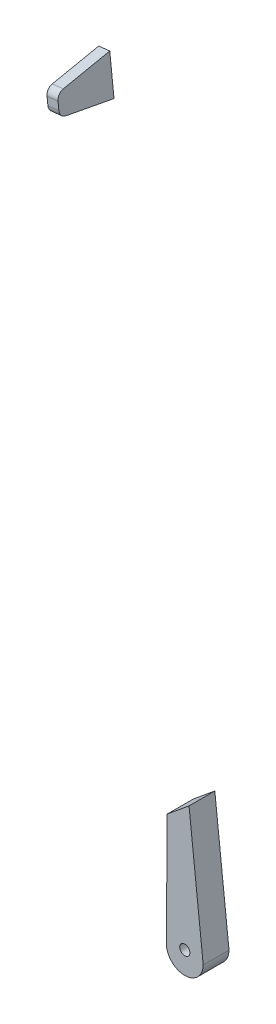
from build123d import *

# Parameters (mm, degrees)
SKETCH1_R                = 1.7526
BOSS_EXTRUDE1_DEPTH      = 8.89
BOSS_EXTRUDE2_DEPTH      = 1.905
BOSS_EXTRUDE2_DEPTH_BACK = 1.905
BOSS_EXTRUDE2_START      = 6.35


with BuildPart() as part:
    # Sketch1 → Boss-Extrude1 (new body)
    with BuildSketch(Plane.XY.offset(686.809186753)):
        with BuildLine():
            Line((1900.888851589, 19.620446581), (1896.001061366, 64.693409066))
            ThreePointArc((1896.001061366, 64.693409066), (1892.243741214, 61.598932687), (1888.49175705, 58.497988698))
            Line((1888.49175705, 58.497988698), (1888.165665709, 19.749246166))
            ThreePointArc((1888.165665709, 19.749246166), (1894.462858856, 13.323253433), (1900.888851589, 19.620446581))
        make_face()
        with Locations((1894.537558365, 20.954804607)):
            Circle(SKETCH1_R, mode=Mode.SUBTRACT)
    extrude(amount=BOSS_EXTRUDE1_DEPTH)


with BuildPart() as body_2:
    # Sketch2 → Boss-Extrude2 (new, two sides: drawn at the far end of the back side and taken through both)
    with BuildSketch(Plane(origin=(1880.901419931, 203.935385675, 0), x_dir=(0, 0, 1), z_dir=(-0.9941715502675706, -0.10780968712771334, 0)).offset(BOSS_EXTRUDE2_START - BOSS_EXTRUDE2_DEPTH_BACK)):
        with BuildLine():
            Line((697.909018497, 72.823574899), (695.608660835, 73.244562676))
            Line((695.608660835, 73.244562676), (695.607635569, 70.25390024))
            Line((695.607635569, 70.25390024), (695.604012875, 59.686643231))
            Line((695.604012875, 59.686643231), (711.930786275, 62.543686297))
            ThreePointArc((711.930786275, 62.543686297), (713.437656121, 63.41172663), (714.032961387, 65.045667386))
            Line((714.032961387, 65.045667386), (714.032961387, 67.755396286))
            ThreePointArc((714.032961387, 67.755396286), (713.443988835, 69.381770136), (711.95021186, 70.25390024))
            Line((711.95021186, 70.25390024), (697.909018497, 72.823574899))
        make_face()
    extrude(amount=BOSS_EXTRUDE2_DEPTH + BOSS_EXTRUDE2_DEPTH_BACK)


solid = Compound([part.part, body_2.part])
